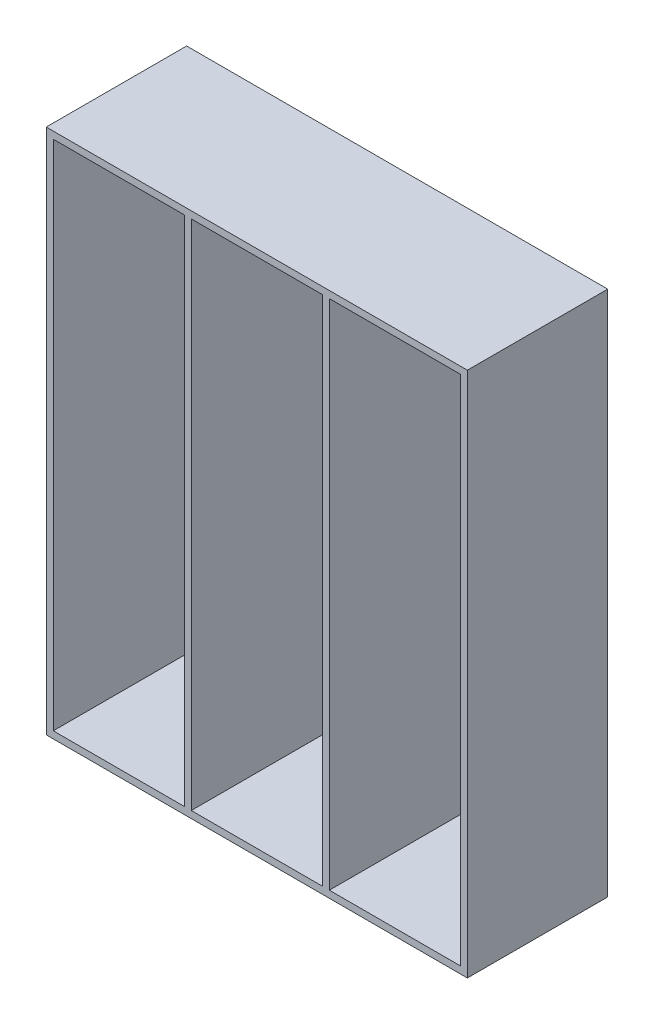
from build123d import *

# Parameters (mm, degrees)
SKETCH1_W           = 60
SKETCH1_H           = 75
BOSS_EXTRUDE1_DEPTH = 20
SKETCH2_W           = 18.666666667
SKETCH2_H           = 73
CUT_EXTRUDE1_DEPTH  = 19
SKETCH3_W           = 18.666666666
SKETCH3_H           = 73
CUT_EXTRUDE2_DEPTH  = 19
SKETCH4_W           = 18.666666667
SKETCH4_H           = 73
CUT_EXTRUDE3_DEPTH  = 19


with BuildPart() as part:
    # Sketch1 → Boss-Extrude1 (new body)
    with BuildSketch(Plane.XY):
        Rectangle(SKETCH1_W, SKETCH1_H)
    extrude(amount=-BOSS_EXTRUDE1_DEPTH)

    # Sketch2 → Cut-Extrude1 (cut)
    with BuildSketch(Plane.XY):
        with Locations((-19.666666667, 0)):
            Rectangle(SKETCH2_W, SKETCH2_H)
    extrude(amount=-CUT_EXTRUDE1_DEPTH, mode=Mode.SUBTRACT)

    # Sketch3 → Cut-Extrude2 (cut)
    with BuildSketch(Plane.XY):
        Rectangle(SKETCH3_W, SKETCH3_H)
    extrude(amount=-CUT_EXTRUDE2_DEPTH, mode=Mode.SUBTRACT)

    # Sketch4 → Cut-Extrude3 (cut)
    with BuildSketch(Plane.XY):
        with Locations((19.666666667, 0)):
            Rectangle(SKETCH4_W, SKETCH4_H)
    extrude(amount=-CUT_EXTRUDE3_DEPTH, mode=Mode.SUBTRACT)


solid = part.part
